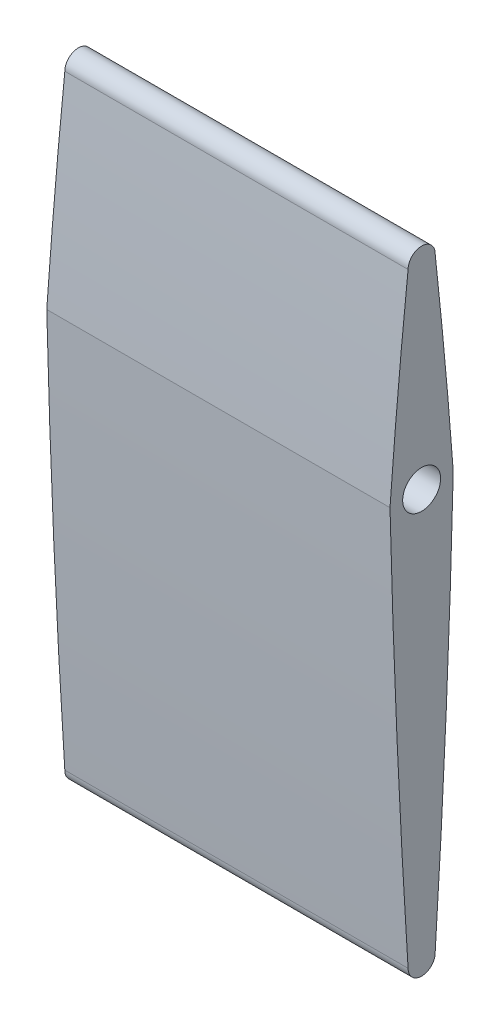
from build123d import *

# Parameters (mm, degrees)
SKETCH1_R           = 2.1
BOSS_EXTRUDE1_DEPTH = 38


with BuildPart() as part:
    # Sketch1 → Boss-Extrude1 (new body)
    with BuildSketch(Plane.YZ):
        with BuildLine():
            ThreePointArc((-45.166666667, 1.5), (-46.666666667, 0), (-45.166666667, -1.5))
            ThreePointArc((-45.166666667, -1.5), (-22.593289689, -2.724847701), (0, -3.5))
            ThreePointArc((0, -3.5), (10.925062805, -2.59165784), (21.833333333, -1.5))
            ThreePointArc((21.833333333, -1.5), (23.333333333, 0), (21.833333333, 1.5))
            ThreePointArc((21.833333333, 1.5), (10.925062805, 2.59165784), (0, 3.5))
            ThreePointArc((0, 3.5), (-22.593289689, 2.724847701), (-45.166666667, 1.5))
        make_face()
        with Locations(Location((0, 0, 0), (0, 0, 270))):
            Circle(SKETCH1_R, mode=Mode.SUBTRACT)
    extrude(amount=BOSS_EXTRUDE1_DEPTH)


solid = part.part
